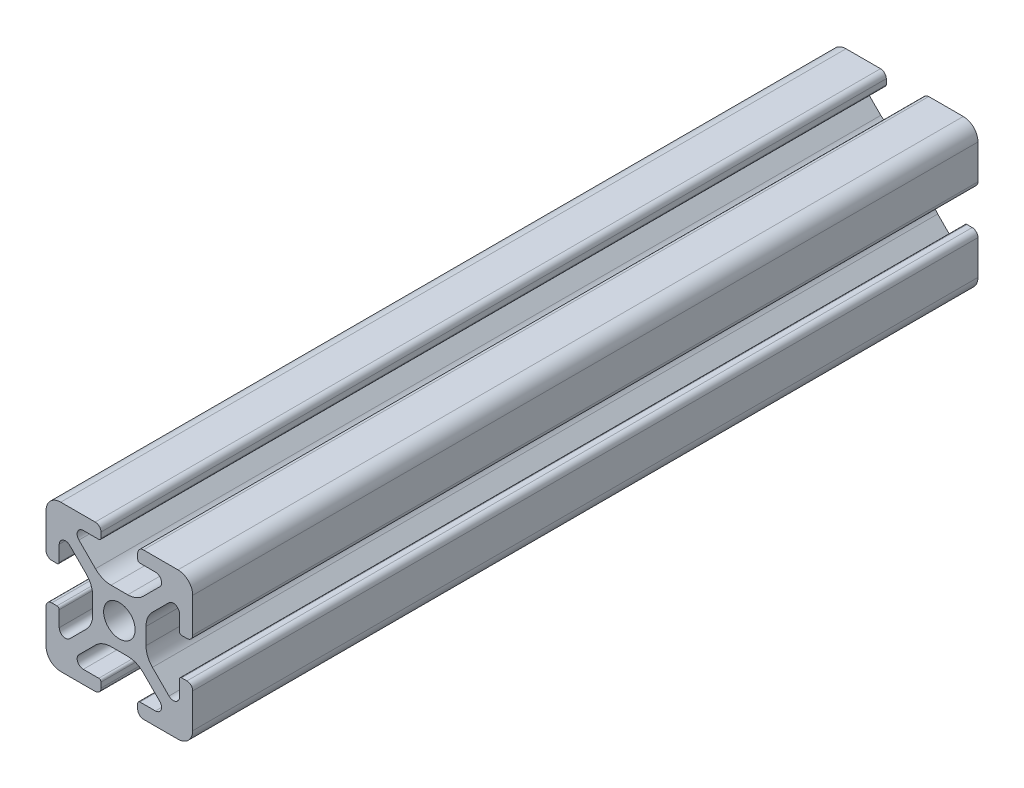
from build123d import *

# Parameters (mm, degrees)
SKETCH1_R           = 2.1463
BOSS_EXTRUDE1_DEPTH = 53.49875


with BuildPart() as part:
    # Sketch1 → Boss-Extrude1 (new, symmetric)
    with BuildSketch(Plane.XY):
        with BuildLine():
            Line((-9.9949, 7.9883), (-9.9949, 3.2893))
            ThreePointArc((-9.9949, 3.2893), (-9.76427588, 2.73252412), (-9.2075, 2.5019))
            Line((-9.2075, 2.5019), (-8.4963, 2.5019))
            ThreePointArc((-8.4963, 2.5019), (-8.280773853, 2.591173853), (-8.1915, 2.8067))
            Line((-8.1915, 2.8067), (-8.1915, 4.9149))
            ThreePointArc((-8.1915, 4.9149), (-7.674065253, 5.689295824), (-6.760603096, 5.507596904))
            Line((-6.760603096, 5.507596904), (-4.505765747, 3.252759555))
            ThreePointArc((-4.505765747, 3.252759555), (-3.856054457, 2.280397894), (-3.627906192, 1.133419111))
            Line((-3.627906192, 1.133419111), (-3.627906192, -1.133419111))
            ThreePointArc((-3.627906192, -1.133419111), (-3.856054457, -2.280397894), (-4.505765747, -3.252759555))
            Line((-4.505765747, -3.252759555), (-6.760603096, -5.507596904))
            ThreePointArc((-6.760603096, -5.507596904), (-7.674065253, -5.689295824), (-8.1915, -4.9149))
            Line((-8.1915, -4.9149), (-8.1915, -2.8067))
            ThreePointArc((-8.1915, -2.8067), (-8.280773853, -2.591173853), (-8.4963, -2.5019))
            Line((-8.4963, -2.5019), (-9.2075, -2.5019))
            ThreePointArc((-9.2075, -2.5019), (-9.76427588, -2.73252412), (-9.9949, -3.2893))
            Line((-9.9949, -3.2893), (-9.9949, -7.9883))
            ThreePointArc((-9.9949, -7.9883), (-9.407180467, -9.407180467), (-7.9883, -9.9949))
            Line((-7.9883, -9.9949), (-3.2893, -9.9949))
            ThreePointArc((-3.2893, -9.9949), (-2.73252412, -9.76427588), (-2.5019, -9.2075))
            Line((-2.5019, -9.2075), (-2.5019, -8.4963))
            ThreePointArc((-2.5019, -8.4963), (-2.591173853, -8.280773853), (-2.8067, -8.1915))
            Line((-2.8067, -8.1915), (-4.9149, -8.1915))
            ThreePointArc((-4.9149, -8.1915), (-5.689295824, -7.674065253), (-5.507596904, -6.760603096))
            Line((-5.507596904, -6.760603096), (-3.252759555, -4.505765747))
            ThreePointArc((-3.252759555, -4.505765747), (-2.280397894, -3.856054457), (-1.133419111, -3.627906192))
            Line((-1.133419111, -3.627906192), (1.133419111, -3.627906192))
            ThreePointArc((1.133419111, -3.627906192), (2.280397894, -3.856054457), (3.252759555, -4.505765747))
            Line((3.252759555, -4.505765747), (5.507596904, -6.760603096))
            ThreePointArc((5.507596904, -6.760603096), (5.689295824, -7.674065253), (4.9149, -8.1915))
            Line((4.9149, -8.1915), (2.8067, -8.1915))
            ThreePointArc((2.8067, -8.1915), (2.591173853, -8.280773853), (2.5019, -8.4963))
            Line((2.5019, -8.4963), (2.5019, -9.2075))
            ThreePointArc((2.5019, -9.2075), (2.73252412, -9.76427588), (3.2893, -9.9949))
            Line((3.2893, -9.9949), (7.9883, -9.9949))
            ThreePointArc((7.9883, -9.9949), (9.407180467, -9.407180467), (9.9949, -7.9883))
            Line((9.9949, -7.9883), (9.9949, -3.2893))
            ThreePointArc((9.9949, -3.2893), (9.76427588, -2.73252412), (9.2075, -2.5019))
            Line((9.2075, -2.5019), (8.4963, -2.5019))
            ThreePointArc((8.4963, -2.5019), (8.280773853, -2.591173853), (8.1915, -2.8067))
            Line((8.1915, -2.8067), (8.1915, -4.9149))
            ThreePointArc((8.1915, -4.9149), (7.674065253, -5.689295824), (6.760603096, -5.507596904))
            Line((6.760603096, -5.507596904), (4.505765747, -3.252759555))
            ThreePointArc((4.505765747, -3.252759555), (3.856054457, -2.280397894), (3.627906192, -1.133419111))
            Line((3.627906192, -1.133419111), (3.627906192, 1.133419111))
            ThreePointArc((3.627906192, 1.133419111), (3.856054457, 2.280397894), (4.505765747, 3.252759555))
            Line((4.505765747, 3.252759555), (6.760603096, 5.507596904))
            ThreePointArc((6.760603096, 5.507596904), (7.674065253, 5.689295824), (8.1915, 4.9149))
            Line((8.1915, 4.9149), (8.1915, 2.8067))
            ThreePointArc((8.1915, 2.8067), (8.280773853, 2.591173853), (8.4963, 2.5019))
            Line((8.4963, 2.5019), (9.2075, 2.5019))
            ThreePointArc((9.2075, 2.5019), (9.76427588, 2.73252412), (9.9949, 3.2893))
            Line((9.9949, 3.2893), (9.9949, 7.9883))
            ThreePointArc((9.9949, 7.9883), (9.407180467, 9.407180467), (7.9883, 9.9949))
            Line((7.9883, 9.9949), (3.2893, 9.9949))
            ThreePointArc((3.2893, 9.9949), (2.73252412, 9.76427588), (2.5019, 9.2075))
            Line((2.5019, 9.2075), (2.5019, 8.4963))
            ThreePointArc((2.5019, 8.4963), (2.591173853, 8.280773853), (2.8067, 8.1915))
            Line((2.8067, 8.1915), (4.9149, 8.1915))
            ThreePointArc((4.9149, 8.1915), (5.689295824, 7.674065253), (5.507596904, 6.760603096))
            Line((5.507596904, 6.760603096), (3.252759555, 4.505765747))
            ThreePointArc((3.252759555, 4.505765747), (2.280397894, 3.856054457), (1.133419111, 3.627906192))
            Line((1.133419111, 3.627906192), (-1.133419111, 3.627906192))
            ThreePointArc((-1.133419111, 3.627906192), (-2.280397894, 3.856054457), (-3.252759555, 4.505765747))
            Line((-3.252759555, 4.505765747), (-5.507596904, 6.760603096))
            ThreePointArc((-5.507596904, 6.760603096), (-5.689295824, 7.674065253), (-4.9149, 8.1915))
            Line((-4.9149, 8.1915), (-2.8067, 8.1915))
            ThreePointArc((-2.8067, 8.1915), (-2.591173853, 8.280773853), (-2.5019, 8.4963))
            Line((-2.5019, 8.4963), (-2.5019, 9.2075))
            ThreePointArc((-2.5019, 9.2075), (-2.73252412, 9.76427588), (-3.2893, 9.9949))
            Line((-3.2893, 9.9949), (-7.9883, 9.9949))
            ThreePointArc((-7.9883, 9.9949), (-9.407180467, 9.407180467), (-9.9949, 7.9883))
        make_face()
        Circle(SKETCH1_R, mode=Mode.SUBTRACT)
    extrude(amount=BOSS_EXTRUDE1_DEPTH, both=True)


solid = part.part
